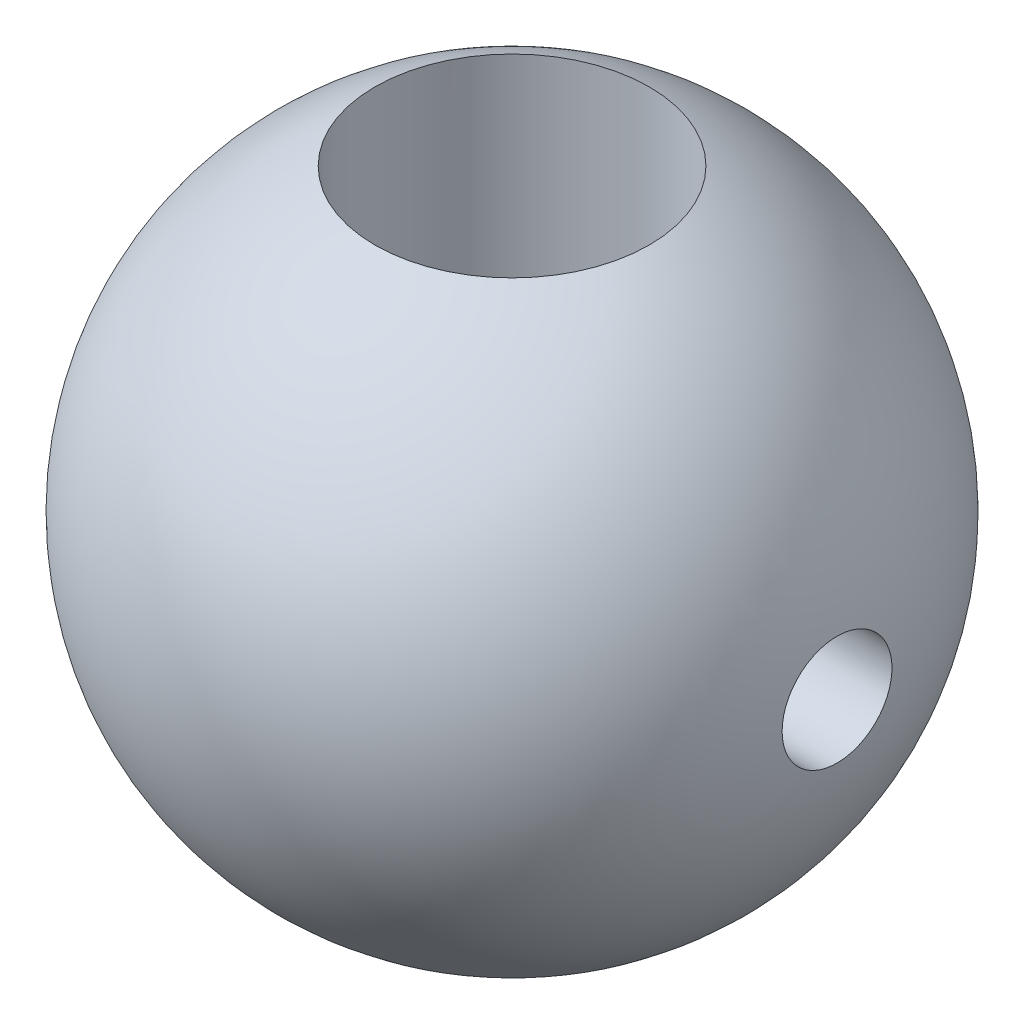
from build123d import *

# Parameters (mm, degrees)
SKETCH2_W = 25.077496915
SKETCH2_H = 1.5875


with BuildPart() as part:
    # Sketch1 → Revolve1 (revolve)
    with BuildSketch(Plane.XY):
        with BuildLine():
            Line((3.9624, 8.661697942), (3.9624, -8.661697942))
            ThreePointArc((3.9624, -8.661697942), (9.525, 0), (3.9624, 8.661697942))
        make_face()
    revolve(axis=Axis((0, 11.238154958, 0), (0, -1, 0)))

    # Sketch2 → Cut-Revolve1 (revolve, cut)
    with BuildSketch(Plane.XY, mode=Mode.PRIVATE) as cut_revolve1_sk:
        with Locations((0.345103168, 0.79375)):
            Rectangle(SKETCH2_W, SKETCH2_H)
    revolve(cut_revolve1_sk.sketch.rotate(Axis((-12.193645289, 0, 0), (1, 0, 0)), 90), axis=Axis((-12.193645289, 0, 0), (1, 0, 0)), mode=Mode.SUBTRACT)


solid = part.part
